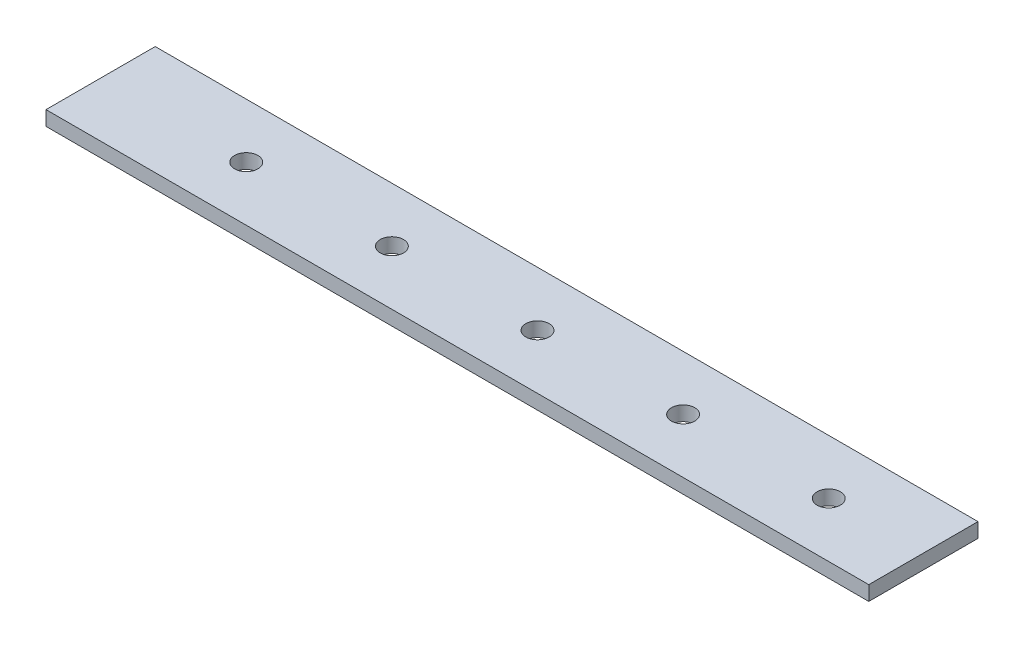
from build123d import *

# Parameters (mm, degrees)
ESQUISSE1_W        = 113
ESQUISSE1_H        = 15
ESQUISSE1_R        = 1.6
BOSS_EXTRU_1_DEPTH = 2


with BuildPart() as part:
    # Esquisse1 → Boss.-Extru.1 (new body)
    with BuildSketch(Plane(origin=(0, 0, 0), x_dir=(1, 0, 0), z_dir=(0, 1, 0))):
        with Locations((56.5, 7.5)):
            Rectangle(ESQUISSE1_W, ESQUISSE1_H)
        with Locations(Location((20, 7.5, 0), (0, 0, 270))):
            Circle(ESQUISSE1_R, mode=Mode.SUBTRACT)
        with Locations(Location((40, 7.5, 0), (0, 0, 270))):
            Circle(ESQUISSE1_R, mode=Mode.SUBTRACT)
        with Locations(Location((60, 7.5, 0), (0, 0, 270))):
            Circle(ESQUISSE1_R, mode=Mode.SUBTRACT)
        with Locations(Location((80, 7.5, 0), (0, 0, 270))):
            Circle(ESQUISSE1_R, mode=Mode.SUBTRACT)
        with Locations(Location((100, 7.5, 0), (0, 0, 270))):
            Circle(ESQUISSE1_R, mode=Mode.SUBTRACT)
    extrude(amount=BOSS_EXTRU_1_DEPTH)


solid = part.part
